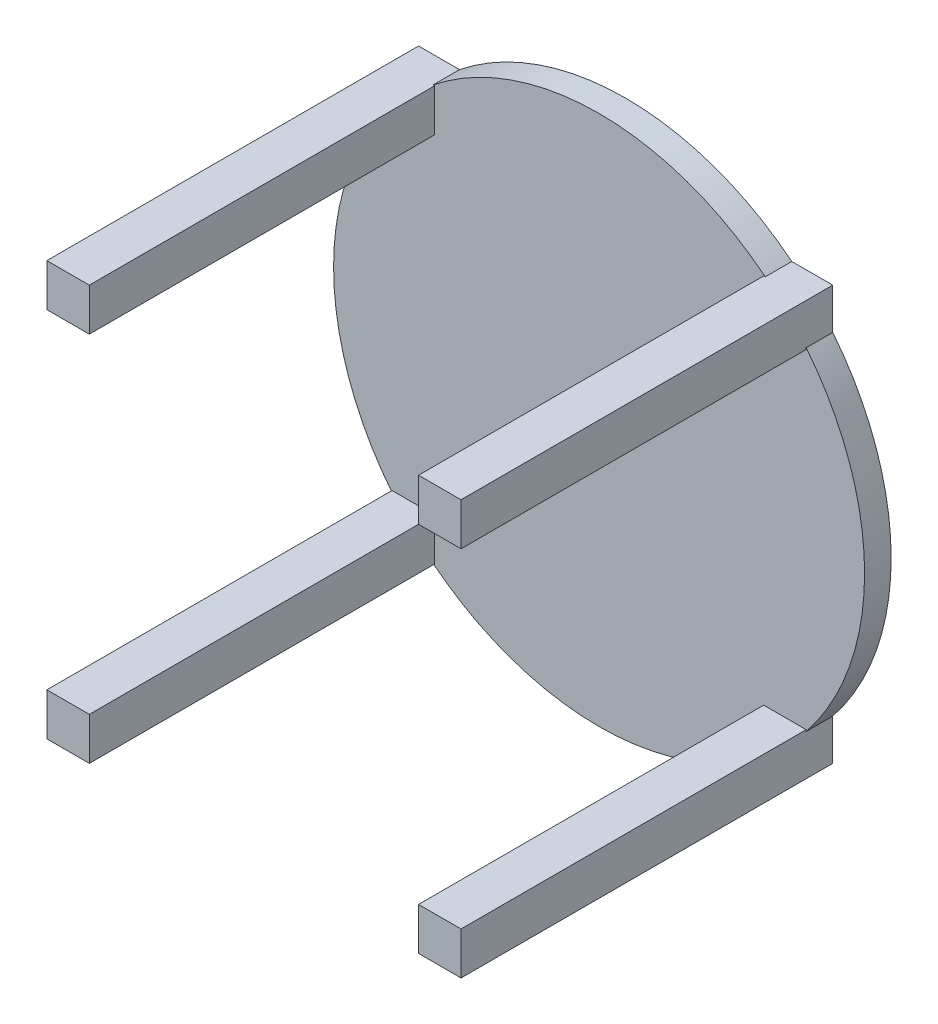
from build123d import *

# Parameters (mm, degrees)
SKETCH_1_R      = 500
EXTRUDE_1_DEPTH = 50
SKETCH_2_W      = 80
SKETCH_2_H      = 80
EXTRUDE_2_DEPTH = 700
SKETCH_3_W      = 80
SKETCH_3_H      = 80
EXTRUDE_3_DEPTH = 700
SKETCH_4_W      = 80
SKETCH_4_H      = 80
EXTRUDE_4_DEPTH = 700
SKETCH_5_W      = 80
SKETCH_5_H      = 80
EXTRUDE_5_DEPTH = 700


with BuildPart() as part:
    # 草图1 → 凸台-拉伸1 (new body)
    with BuildSketch(Plane.XY):
        Circle(SKETCH_1_R)
    extrude(amount=EXTRUDE_1_DEPTH)

    # 草图2 → 凸台-拉伸2 (add)
    with BuildSketch(Plane.XY):
        with Locations((350, 350)):
            Rectangle(SKETCH_2_W, SKETCH_2_H)
    extrude(amount=EXTRUDE_2_DEPTH)

    # 草图3 → 凸台-拉伸3 (add)
    with BuildSketch(Plane.XY):
        with Locations((-350, 350)):
            Rectangle(SKETCH_3_W, SKETCH_3_H)
    extrude(amount=EXTRUDE_3_DEPTH)

    # 草图4 → 凸台-拉伸4 (add)
    with BuildSketch(Plane.XY):
        with Locations((-350, -350)):
            Rectangle(SKETCH_4_W, SKETCH_4_H)
    extrude(amount=EXTRUDE_4_DEPTH)

    # 草图5 → 凸台-拉伸5 (add)
    with BuildSketch(Plane.XY):
        with Locations((350, -350)):
            Rectangle(SKETCH_5_W, SKETCH_5_H)
    extrude(amount=EXTRUDE_5_DEPTH)


solid = part.part
